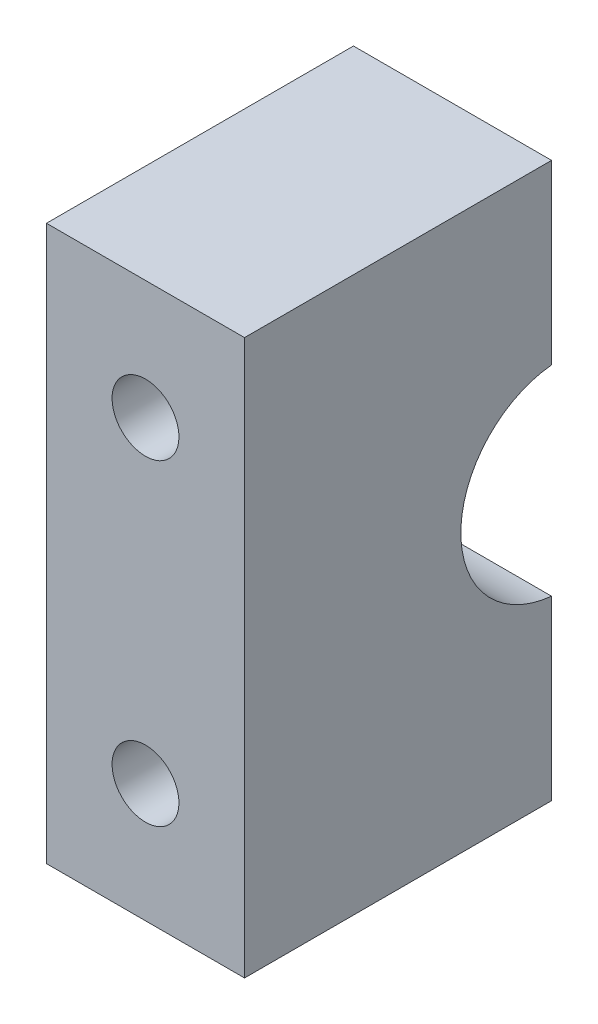
from build123d import *

# Parameters (mm, degrees)
BASE_EXTRUDE_DEPTH               = 15.875
F_1_2_13_TAPPED_HOLE2_AT_2_COUNT = 2
F_1_2_13_TAPPED_HOLE2_AT_2_PITCH = 50.8


with BuildPart() as part:
    # Sketch1 → Base-Extrude (new, symmetric)
    with BuildSketch(Plane(origin=(0, 0, 0), x_dir=(0, 0, -1), z_dir=(1, 0, 0))):
        with BuildLine():
            Line((-50.8, 44.45), (-50.8, -44.45))
            Line((-50.8, -44.45), (-1.5875, -44.45))
            Line((-1.5875, -44.45), (-1.5875, -16.050684869))
            ThreePointArc((-1.5875, -16.050684869), (-16.129, 0), (-1.5875, 16.050684869))
            Line((-1.5875, 16.050684869), (-1.5875, 44.45))
            Line((-1.5875, 44.45), (-50.8, 44.45))
        make_face()
    extrude(amount=BASE_EXTRUDE_DEPTH, both=True)

    # Sketch6 → 1/2-13 Tapped Hole2 (revolve, cut)
    with BuildSketch(Plane(origin=(0, 25.4, 1.5875), x_dir=(0, 1, 0), z_dir=(1, 0, 0))):
        Polygon((0, 0), (0, 49.2125), (5.35813, 49.2125), (5.35813, 25.4), (6.35, 25.4), (6.35, 0.79375), (7.14375, 0), align=None)
    f_1_2_13_tapped_hole2 = revolve(axis=Axis((0, 25.4, -4.7625), (0, 0, 1)), mode=Mode.SUBTRACT)

    # 1/2-13 Tapped Hole2 at 2: 1/2-13 Tapped Hole2 ×2
    with Locations(*[(0, -i * F_1_2_13_TAPPED_HOLE2_AT_2_PITCH, 0) for i in range(1, F_1_2_13_TAPPED_HOLE2_AT_2_COUNT)]):
        add(f_1_2_13_tapped_hole2, mode=Mode.SUBTRACT)


solid = part.part
